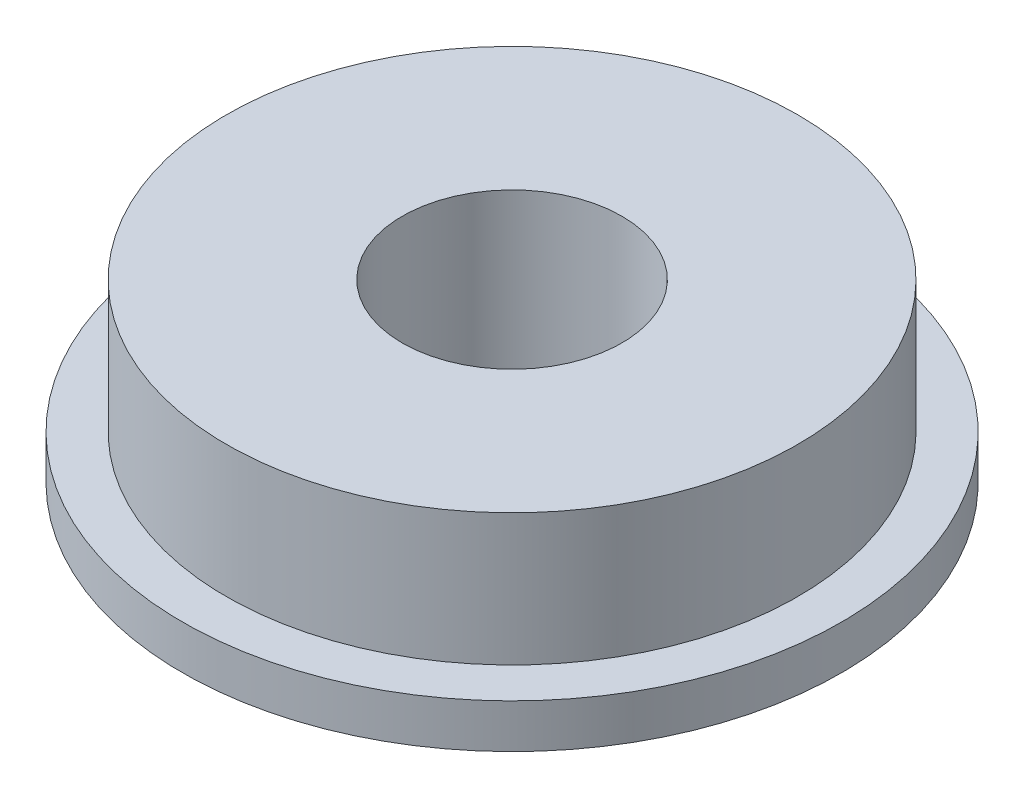
from build123d import *


with BuildPart() as part:
    # 草图1 → 旋转1 (revolve)
    with BuildSketch(Plane.XY, mode=Mode.PRIVATE) as revolve_1_sk:
        Polygon((2.5, 0), (2.5, 4), (6.5, 4), (6.5, 1), (7.5, 1), (7.5, 0), align=None)
    revolve(revolve_1_sk.sketch.rotate(Axis((0, 0, 0), (0, 1, 0)), 90), axis=Axis((0, 0, 0), (0, 1, 0)))


solid = part.part
